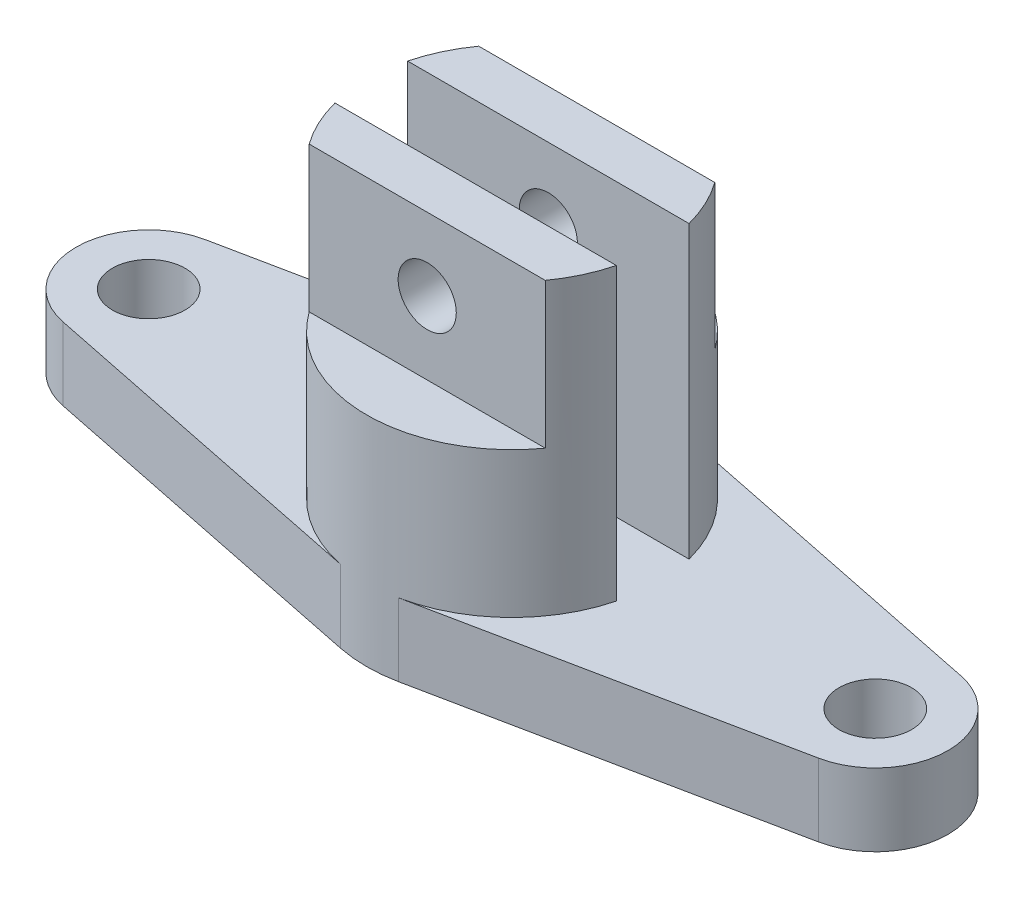
from build123d import *

# Parameters (mm, degrees)
BOSS_EXTRUDE1_DEPTH   = 75
BOSS_EXTRUDE1_2_DEPTH = 75
BOSS_EXTRUDE2_DEPTH   = 45
SKETCH1_5_R           = 7.5
BOSS_EXTRUDE3_DEPTH   = 15
SKETCH2_R             = 6
CUT_EXTRUDE1_DEPTH    = 127.416968798


with BuildPart() as part:
    # Sketch1 → Boss-Extrude1 (new body)
    with BuildSketch(Plane(origin=(0, 0, 0), x_dir=(1, 0, 0), z_dir=(0, 1, 0))):
        with BuildLine():
            Line((24.366985862, 17.5), (-24.366985862, 17.5))
            ThreePointArc((-24.366985862, 17.5), (-27.171188586, 12.717173855), (-29.047375097, 7.5))
            Line((-29.047375097, 7.5), (29.047375097, 7.5))
            ThreePointArc((29.047375097, 7.5), (27.171188586, 12.717173855), (24.366985862, 17.5))
        make_face()
    extrude(amount=BOSS_EXTRUDE1_DEPTH)



with BuildPart() as body_2:
    # Sketch1 → Boss-Extrude1 2 (new body)
    with BuildSketch(Plane(origin=(0, 0, 0), x_dir=(1, 0, 0), z_dir=(0, 1, 0))):
        with BuildLine():
            ThreePointArc((-29.047375097, -7.5), (-27.171188586, -12.717173855), (-24.366985862, -17.5))
            Line((-24.366985862, -17.5), (24.366985862, -17.5))
            ThreePointArc((24.366985862, -17.5), (27.171188586, -12.717173855), (29.047375097, -7.5))
            Line((29.047375097, -7.5), (-29.047375097, -7.5))
        make_face()
    extrude(amount=BOSS_EXTRUDE1_2_DEPTH)


with BuildPart() as part_1:
    add(part.part)

    add(body_2.part)  # Boss-Extrude2 merges body 2
    # Sketch1<4> → Boss-Extrude2 (add)
    with BuildSketch(Plane(origin=(0, 0, 0), x_dir=(1, 0, 0), z_dir=(0, 1, 0))):
        with BuildLine():
            ThreePointArc((24.366985862, 17.5), (0, 30), (-24.366985862, 17.5))
            Line((-24.366985862, 17.5), (24.366985862, 17.5))
        make_face()
        with BuildLine():
            ThreePointArc((-24.366985862, -17.5), (0, -30), (24.366985862, -17.5))
            Line((24.366985862, -17.5), (-24.366985862, -17.5))
        make_face()
    extrude(amount=BOSS_EXTRUDE2_DEPTH)

    # Sketch1<5> → Boss-Extrude3 (add)
    with BuildSketch(Plane(origin=(0, 0, 0), x_dir=(1, 0, 0), z_dir=(0, 1, 0))):
        with BuildLine():
            ThreePointArc((-29.047375097, 7.5), (-27.171188586, 12.717173855), (-24.366985862, 17.5))
            ThreePointArc((-24.366985862, 17.5), (-16.306579488, 25.18125226), (-6, 29.393876913))
            Line((-6, 29.393876913), (-78, 14.696938457))
            ThreePointArc((-78, 14.696938457), (-90, 0), (-78, -14.696938457))
            Line((-78, -14.696938457), (-6, -29.393876913))
            ThreePointArc((-6, -29.393876913), (-16.306579488, -25.18125226), (-24.366985862, -17.5))
            ThreePointArc((-24.366985862, -17.5), (-27.171188586, -12.717173855), (-29.047375097, -7.5))
            Line((-29.047375097, -7.5), (29.047375097, -7.5))
            ThreePointArc((29.047375097, -7.5), (27.171188586, -12.717173855), (24.366985862, -17.5))
            ThreePointArc((24.366985862, -17.5), (16.306579488, -25.18125226), (6, -29.393876913))
            Line((6, -29.393876913), (78, -14.696938457))
            ThreePointArc((78, -14.696938457), (90, 0), (78, 14.696938457))
            Line((78, 14.696938457), (6, 29.393876913))
            ThreePointArc((6, 29.393876913), (16.306579488, 25.18125226), (24.366985862, 17.5))
            ThreePointArc((24.366985862, 17.5), (27.171188586, 12.717173855), (29.047375097, 7.5))
            Line((29.047375097, 7.5), (-29.047375097, 7.5))
        make_face()
        with Locations((-75, 0)):
            Circle(SKETCH1_5_R, mode=Mode.SUBTRACT)
        with Locations((75, 0)):
            Circle(SKETCH1_5_R, mode=Mode.SUBTRACT)
    extrude(amount=BOSS_EXTRUDE3_DEPTH)

    # Sketch2 → Cut-Extrude1 (cut, through all)
    with BuildSketch(Plane.XY.offset(17.5)):
        with Locations((0, 60)):
            Circle(SKETCH2_R)
    extrude(amount=-CUT_EXTRUDE1_DEPTH, mode=Mode.SUBTRACT)


solid = part_1.part
